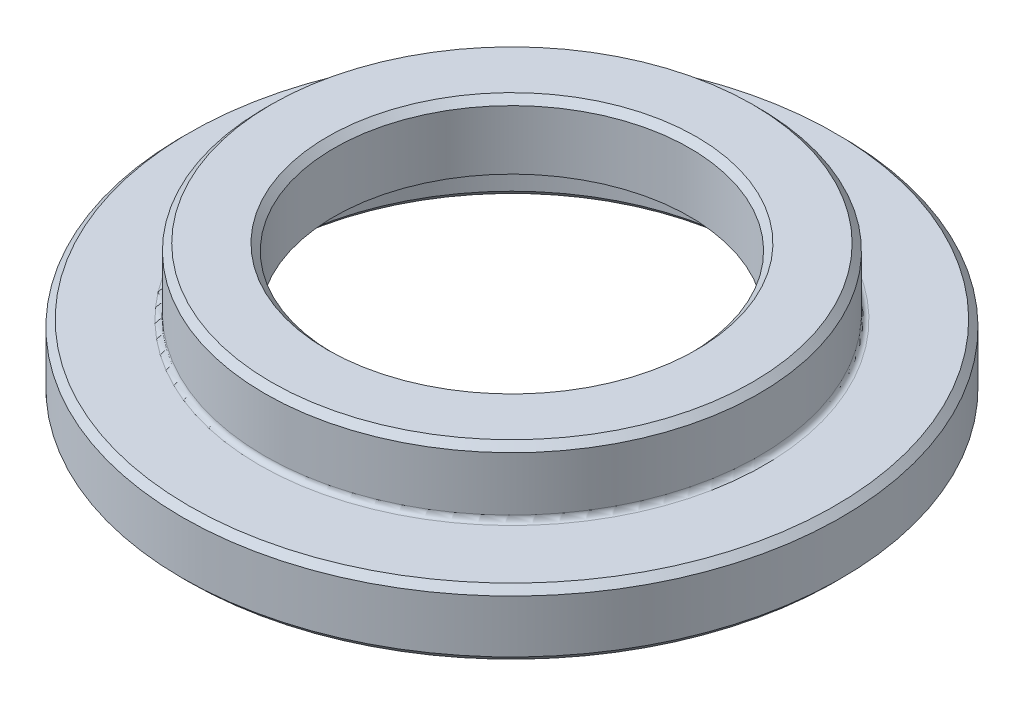
from build123d import *

# Parameters (mm, degrees)
SKETCH2_R           = 12.7
SKETCH2_R_2         = 9.2837
BOSS_EXTRUDE1_DEPTH = 2.54
SKETCH3_R           = 9.525
SKETCH3_R_2         = 6.858
BOSS_EXTRUDE2_DEPTH = 2.54
FILLET1_R           = 0.2032
CHAMFER1_SIZE       = 0.254


with BuildPart() as part:
    # Sketch2 → Boss-Extrude1 (new body)
    with BuildSketch(Plane(origin=(0, 0, 0), x_dir=(1, 0, 0), z_dir=(0, 1, 0))):
        with Locations(Location((0, 0, 0), (0, 0, 270))):
            Circle(SKETCH2_R)
        with Locations(Location((0, 0, 0), (0, 0, 270))):
            Circle(SKETCH2_R_2, mode=Mode.SUBTRACT)
    extrude(amount=BOSS_EXTRUDE1_DEPTH)

    # Sketch3 → Boss-Extrude2 (add)
    with BuildSketch(Plane(origin=(0, 2.54, 0), x_dir=(1, 0, 0), z_dir=(0, 1, 0))):
        with Locations(Location((0, 0, 0), (0, 0, 270))):
            Circle(SKETCH3_R)
        with Locations(Location((0, 0, 0), (0, 0, 270))):
            Circle(SKETCH3_R_2, mode=Mode.SUBTRACT)
    extrude(amount=BOSS_EXTRUDE2_DEPTH)

    # Fillet1
    fillet1_edges = [part.edges().sort_by_distance(p)[0] for p in [
        (0, 2.54, -9.2837),
        (0, 2.54, -9.525),
    ]]
    fillet(fillet1_edges, radius=FILLET1_R)

    # Chamfer1
    chamfer1_edges = [part.edges().sort_by_distance(p)[0] for p in [
        (0, 5.08, -6.858),
        (0, 2.54, -12.7),
        (0, 0, -12.7),
        (0, 0, -9.2837),
        (0, 5.08, -9.525),
    ]]
    chamfer(chamfer1_edges, length=CHAMFER1_SIZE)


solid = part.part
